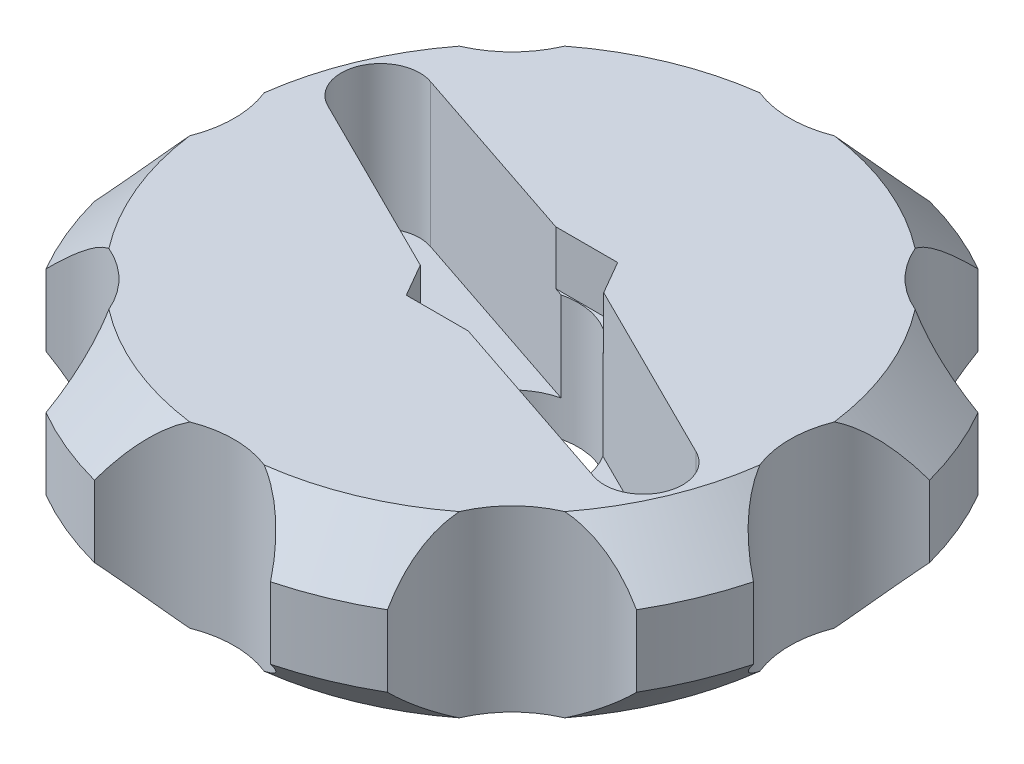
from build123d import *
from build123d.topology import SkipClean

# Parameters (mm, degrees)
BOSS_EXTRUDE1_DEPTH  = 10
CHAMFER1_SIZE        = 3
M4_CLEARANCE_HOLE1_D = 4.8
CUT_EXTRUDE1_START   = -8
SKETCH4_R            = 3.7
SKETCH4_R_2          = 2.4
CUT_EXTRUDE1_DEPTH   = 8
SKETCH4_3_R          = 3.7
SKETCH4_3_R_2        = 2.4
CUT_EXTRUDE2_DEPTH   = 28.935018749
CUT_EXTRUDE3_DEPTH   = 3


with BuildPart() as part:
    # Sketch1 → Boss-Extrude1 (new body)
    with BuildSketch(Plane(origin=(0, 0, 0), x_dir=(1, 0, 0), z_dir=(0, 1, 0))):
        with BuildLine():
            ThreePointArc((4.929173178, -18.444040543), (0, -15.55551692), (-4.929173178, -18.444040543))
            ThreePointArc((-4.929173178, -18.444040543), (-7.30594069, -17.6381011), (-9.556454361, -16.527357921))
            ThreePointArc((-9.556454361, -16.527357921), (-10.999411499, -10.999411499), (-16.527357921, -9.556454361))
            ThreePointArc((-16.527357921, -9.556454361), (-17.6381011, -7.30594069), (-18.444040543, -4.929173178))
            ThreePointArc((-18.444040543, -4.929173178), (-15.55551692, 0), (-18.444040543, 4.929173178))
            ThreePointArc((-18.444040543, 4.929173178), (-17.6381011, 7.30594069), (-16.527357921, 9.556454361))
            ThreePointArc((-16.527357921, 9.556454361), (-10.999411499, 10.999411499), (-9.556454361, 16.527357921))
            ThreePointArc((-9.556454361, 16.527357921), (-7.30594069, 17.6381011), (-4.929173178, 18.444040543))
            ThreePointArc((-4.929173178, 18.444040543), (0, 15.55551692), (4.929173178, 18.444040543))
            ThreePointArc((4.929173178, 18.444040543), (7.30594069, 17.6381011), (9.556454361, 16.527357921))
            ThreePointArc((9.556454361, 16.527357921), (10.999411499, 10.999411499), (16.527357921, 9.556454361))
            ThreePointArc((16.527357921, 9.556454361), (17.6381011, 7.30594069), (18.444040543, 4.929173178))
            ThreePointArc((18.444040543, 4.929173178), (15.55551692, 0), (18.444040543, -4.929173178))
            ThreePointArc((18.444040543, -4.929173178), (17.6381011, -7.30594069), (16.527357921, -9.556454361))
            ThreePointArc((16.527357921, -9.556454361), (10.999411499, -10.999411499), (9.556454361, -16.527357921))
            ThreePointArc((9.556454361, -16.527357921), (7.30594069, -17.6381011), (4.929173178, -18.444040543))
        make_face()
    extrude(amount=BOSS_EXTRUDE1_DEPTH)

    # Chamfer1
    chamfer1_edges = [part.edges().sort_by_distance(p)[0] for p in [
        (7.30594069, 10, -17.6381011),
        (17.6381011, 0, 7.30594069),
        (7.30594069, 0, 17.6381011),
        (-7.30594069, 0, 17.6381011),
        (-17.6381011, 0, 7.30594069),
        (-17.6381011, 0, -7.30594069),
        (-7.30594069, 0, -17.6381011),
        (-7.30594069, 10, -17.6381011),
        (7.30594069, 0, -17.6381011),
        (17.6381011, 0, -7.30594069),
        (-17.6381011, 10, -7.30594069),
        (-17.6381011, 10, 7.30594069),
        (-7.30594069, 10, 17.6381011),
        (17.6381011, 10, -7.30594069),
        (7.30594069, 10, 17.6381011),
        (17.6381011, 10, 7.30594069),
    ]]
    chamfer(chamfer1_edges, length=CHAMFER1_SIZE)

    # M4 Clearance Hole1 (through all)
    with Locations(Plane(origin=(0, 10, 0), x_dir=(1, 0, 0), z_dir=(0, 1, 0))):
        with Locations((0, 0)):
            Hole(M4_CLEARANCE_HOLE1_D / 2)

    # Sketch4 → Cut-Extrude1 (cut)
    # profile 1 of 4: a face of its own
    with BuildSketch(Plane(origin=(0, 10, 0), x_dir=(1, 0, 0), z_dir=(0, 1, 0)).offset(CUT_EXTRUDE1_START)):
        with BuildLine():
            ThreePointArc((-11.865806229, 7.290510339), (-14.597296614, 6.046398231), (-13.545561348, 3.23522275))
            Line((-13.545561348, 3.23522275), (-3.148841491, -1.94288375))
            ThreePointArc((-3.148841491, -1.94288375), (-3.41835427, 1.4159287), (-0.852740897, 3.600393446))
            Line((-0.852740897, 3.600393446), (-11.865806229, 7.290510339))
        make_face()
    # profile 2 of 4: a face of its own
    with BuildSketch(Plane(origin=(0, 10, 0), x_dir=(1, 0, 0), z_dir=(0, 1, 0)).offset(CUT_EXTRUDE1_START)):
        Circle(SKETCH4_R)
        with Locations(Location((0, 0, 0), (0, 0, 270))):
            Circle(SKETCH4_R_2, mode=Mode.SUBTRACT)
    # profile 3 of 4: a face of its own
    with BuildSketch(Plane(origin=(0, 10, 0), x_dir=(1, 0, 0), z_dir=(0, 1, 0)).offset(CUT_EXTRUDE1_START)):
        with Locations(Location((0, 0, 0), (0, 0, 270))):
            Circle(SKETCH4_R_2)
    # profile 4 of 4: a face of its own
    with BuildSketch(Plane(origin=(0, 10, 0), x_dir=(1, 0, 0), z_dir=(0, 1, 0)).offset(CUT_EXTRUDE1_START)):
        with BuildLine():
            ThreePointArc((3.7, 0), (2.902166546, -2.29508809), (0.852740897, -3.600393446))
            Line((0.852740897, -3.600393446), (11.865806229, -7.290510339))
            ThreePointArc((11.865806229, -7.290510339), (14.597296614, -6.046398231), (13.545561348, -3.23522275))
            Line((13.545561348, -3.23522275), (3.148841491, 1.94288375))
            ThreePointArc((3.148841491, 1.94288375), (3.559544459, 1.009773857), (3.7, 0))
        make_face()
    extrude(amount=CUT_EXTRUDE1_DEPTH, mode=Mode.SUBTRACT)

    # Sketch4<3> → Cut-Extrude2 (cut, through all)
    # profile 1 of 2: a face of its own
    with SkipClean():  # the faces are left unmerged after this step: merging them gives an invalid solid
        with BuildSketch(Plane(origin=(0, 10, 0), x_dir=(1, 0, 0), z_dir=(0, 1, 0))):
            with Locations(Location((0, 0, 0), (0, 0, 270))):
                Circle(SKETCH4_3_R)
            Circle(SKETCH4_3_R_2, mode=Mode.SUBTRACT)
        # profile 2 of 2: a face of its own
        with BuildSketch(Plane(origin=(0, 10, 0), x_dir=(1, 0, 0), z_dir=(0, 1, 0))):
            Circle(SKETCH4_3_R_2)
        extrude(amount=-CUT_EXTRUDE2_DEPTH, mode=Mode.SUBTRACT)

    # Sketch5 → Cut-Extrude3 (cut)
    with SkipClean():  # the faces are left unmerged after this step: merging them gives an invalid solid
        with BuildSketch(Plane(origin=(0, 10, 0), x_dir=(1, 0, 0), z_dir=(0, 1, 0))):
            Polygon((2.165063509, -3.75), (4.330127019, 0), (2.165063509, 3.75), (-2.165063509, 3.75), (-4.330127019, 0), (-2.165063509, -3.75), align=None)
        extrude(amount=-CUT_EXTRUDE3_DEPTH, mode=Mode.SUBTRACT)


solid = part.part
